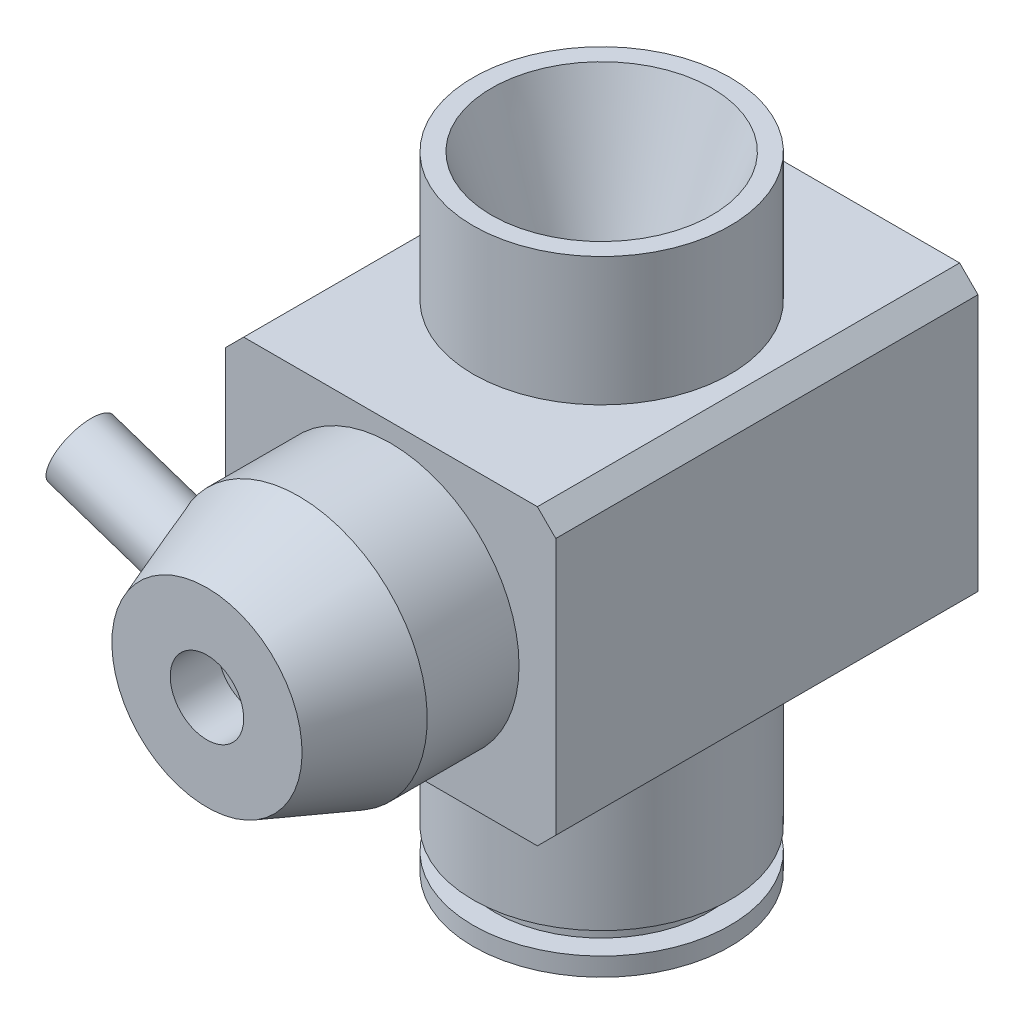
from build123d import *

# Parameters (mm, degrees)
ESQUISSE1_W                  = 18
ESQUISSE1_H                  = 16
ESQUISSE1_R                  = 6
BASE_EXTRUSION_DEPTH         = 11.5
ESQUISSE6_R                  = 3.506411758
ENL_V_MAT_EXTRU_1_DEPTH      = 28.244265452
CHANFREIN1_SIZE              = 1
ESQUISSE9_W                  = 7.559075372
ESQUISSE9_H                  = 1.8
ENL_V_MAT_EXTRU_2_REACH      = 38.326
ENL_V_MAT_EXTRU_2_END_RADIUS = 1
ESQUISSE10_R                 = 1


with BuildPart() as part:
    # Esquisse1 → Base-Extrusion (new, symmetric)
    with BuildSketch(Plane.XY):
        with Locations((0, 8)):
            Rectangle(ESQUISSE1_W, ESQUISSE1_H)
        with Locations((0, 8)):
            Circle(ESQUISSE1_R, mode=Mode.SUBTRACT)
    extrude(amount=BASE_EXTRUSION_DEPTH, both=True)

    # Esquisse5 → Boss.-Révol.1 (revolve)
    with BuildSketch(Plane(origin=(0, 0, 0), x_dir=(0, 0, -1), z_dir=(1, 0, 0)), mode=Mode.PRIVATE) as boss_r_vol_1_sk:
        Polygon((7, -10), (7, -11), (5.5, -11), (3.506411758, 0), (7, 0), (7, -8.8), (5.8, -8.8), (5.8, -10), align=None)
        Polygon((7, 16), (3.5, 16), (6, 23), (7, 23), align=None)
    revolve(boss_r_vol_1_sk.sketch.rotate(Axis((0, 26.536034952, 0), (0, -1, 0)), 180), axis=Axis((0, 26.536034952, 0), (0, -1, 0)))

    # Esquisse6 → Enlèv. mat.-Extru.1 (cut, through all)
    with BuildSketch(Plane.XZ):
        Circle(ESQUISSE6_R)
    extrude(amount=-ENL_V_MAT_EXTRU_1_DEPTH, mode=Mode.SUBTRACT)

    # Esquisse8 → Boss.-Révol.2 (revolve)
    with BuildSketch(Plane(origin=(0, 0, 0), x_dir=(0, 0, -1), z_dir=(1, 0, 0))):
        Polygon((-11.5, 15), (-16.5, 15), (-21.5, 13.180148829), (-21.5, 10), (-18.894611613, 10), (-18.894611613, 9), (-5.574935919, 9), (-5.574935919, 9.8), (-11.5, 9.8), align=None)
    revolve(axis=Axis((0, 8, 5.789251087), (0, 0, 1)))

    # Chanfrein1
    chanfrein1_edges = [part.edges().sort_by_distance(p)[0] for p in [
        (9, 16, 0),
        (9, 0, 0),
        (-9, 0, 0),
        (-9, 16, 0),
    ]]
    chamfer(chanfrein1_edges, length=CHANFREIN1_SIZE)

    # Esquisse9 → Boss.-Révol.3 (revolve)
    with BuildSketch(Plane(origin=(2.407260093, 7.19454204, 0), x_dir=(-0.9483236552062002, 0.31730465640508954, 0), z_dir=(0.31730465640508954, 0.9483236552062002, 0)), mode=Mode.PRIVATE) as boss_r_vol_3_sk:
        with Locations((10.758899565, 17.9)):
            Rectangle(ESQUISSE9_W, ESQUISSE9_H)
    revolve(boss_r_vol_3_sk.sketch.rotate(Axis((0, 8, 17), (-0.9483236552062002, 0.3173046564050896, 0)), 90), axis=Axis((0, 8, 17), (-0.9483236552062002, 0.3173046564050896, 0)))

    # Enlèv. mat.-Extru.2: up to this cylinder (the profile starts outside it)
    enl_v_mat_extru_2_end = Plane(origin=(0, 8, 17), z_dir=(0, 0, -1)) * Cylinder(ENL_V_MAT_EXTRU_2_END_RADIUS, 79.652, mode=Mode.PRIVATE)
    # Esquisse10 → Enlèv. mat.-Extru.2 (cut, up to the surface)
    with BuildSketch(Plane(origin=(-13.787143955, 4.613113837, 0), x_dir=(0, 0, 1), z_dir=(-0.9483236552062002, 0.31730465640508954, 0)), mode=Mode.PRIVATE) as enl_v_mat_extru_2_sk1:
        with Locations(Location((17, 7.586589242, 0), (0, 0, 270))):
            Circle(ESQUISSE10_R)
    enl_v_mat_extru_2_tool1 = extrude(enl_v_mat_extru_2_sk1.sketch, amount=-ENL_V_MAT_EXTRU_2_REACH, mode=Mode.PRIVATE) - enl_v_mat_extru_2_end
    add(enl_v_mat_extru_2_tool1.solids().sort_by_distance((-11.379884, 11.807656, 17))[0], mode=Mode.SUBTRACT)


solid = part.part
